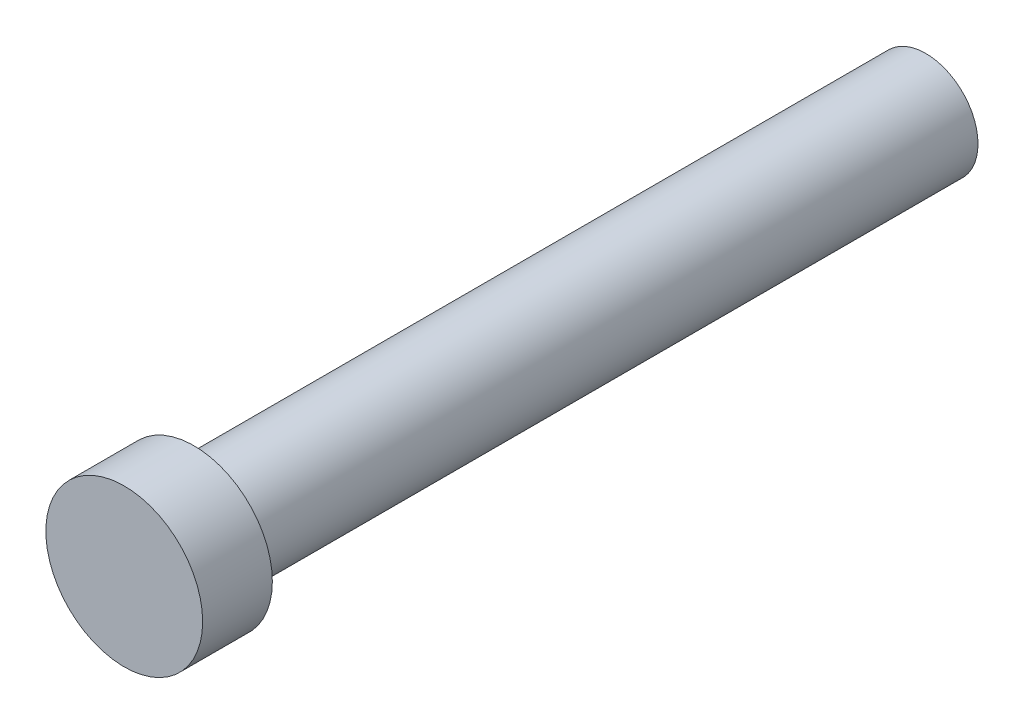
from build123d import *

# Parameters (mm, degrees)
SKETCH1_R           = 22.5
BOSS_EXTRUDE1_DEPTH = 20
SKETCH2_W           = 210
SKETCH2_H           = 15


with BuildPart() as part:
    # Sketch1 → Boss-Extrude1 (new body)
    with BuildSketch(Plane.XY):
        Circle(SKETCH1_R)
    extrude(amount=BOSS_EXTRUDE1_DEPTH)

    # Sketch2 → Revolve2 (revolve)
    with BuildSketch(Plane(origin=(0, 0, 0), x_dir=(0, 0, -1), z_dir=(1, 0, 0)), mode=Mode.PRIVATE) as revolve2_sk:
        with Locations((105, 7.5)):
            Rectangle(SKETCH2_W, SKETCH2_H)
    revolve(revolve2_sk.sketch.rotate(Axis((0, 0, 38.403448712), (0, 0, -1)), 90), axis=Axis((0, 0, 38.403448712), (0, 0, -1)))


solid = part.part
